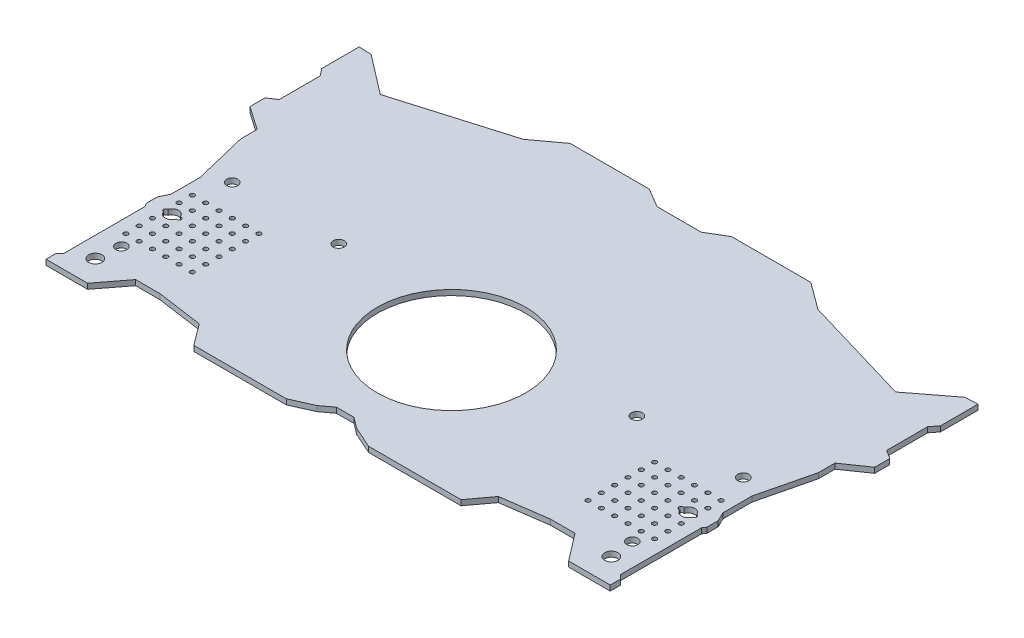
from build123d import *

# Parameters (mm, degrees)
CROQUIS1_R              = 1.5
CROQUIS1_R_2            = 1.25
CROQUIS1_R_3            = 0.5
CROQUIS1_R_4            = 16.7385
SALIENTE_EXTRUIR1_DEPTH = 1.2


with BuildPart() as part:
    # Croquis1 → Saliente-Extruir1 (new body)
    with BuildSketch(Plane(origin=(0, 0, 0), x_dir=(1, 0, 0), z_dir=(0, 1, 0))):
        Polygon((-2.771345295, 39.386037037), (-7.047345295, 41.930037037), (-24.910345295, 41.930037037), (-30.983345295, 37.451037037), (-55.870345295, 30.085037037), (-64.724345295, 36.871037037), (-67.534345295, 36.997037037), (-67.534345295, 28.550037037), (-66.267345295, 26.929037037), (-66.267345295, 17.685037037), (-68.205345295, 16.424037037), (-68.205345295, 13.036037037), (-62.917345295, 9.371037037), (-62.917345295, 5.635037037), (-59.989345295, -6.392962963), (-59.991845295, -12.965462963), (-60.994345295, -15.057962963), (-60.994345295, -17.608962963), (-60.508345295, -18.283962963), (-60.508345295, -36.567962963), (-61.380345295, -37.497962963), (-61.380345295, -39.774962963), (-52.005345295, -39.774962963), (-47.313345295, -33.644962963), (-41.787345295, -33.644962963), (-31.487345295, -35.104962963), (-27.910345295, -39.930962963), (-7.047345295, -39.930962963), (-2.276345295, -37.799962963), (0.263654705, -35.915962963), (4.190654705, -35.915962963), (6.730654705, -37.799962963), (11.501654705, -39.930962963), (32.364654705, -39.930962963), (35.941654705, -35.104962963), (46.241654705, -33.644962963), (51.767654705, -33.644962963), (56.459654705, -39.774962963), (65.834654705, -39.774962963), (65.834654705, -37.497962963), (64.962654705, -36.567962963), (64.962654705, -18.283962963), (65.448654705, -17.608962963), (65.448654705, -15.057962963), (64.446154705, -12.965462963), (64.443654705, -6.392962963), (67.371654705, 5.635037037), (67.371654705, 9.371037037), (72.659654705, 13.036037037), (72.659654705, 16.424037037), (70.721654705, 17.685037037), (70.721654705, 26.929037037), (71.988654705, 28.550037037), (71.988654705, 36.997037037), (69.178654705, 36.871037037), (60.324654705, 30.085037037), (35.437654705, 37.451037037), (29.364654705, 41.930037037), (11.501654705, 41.930037037), (7.225654705, 39.386037037), align=None)
        with Locations(Location((-55.949345295, -34.085962963, 0), (0, 0, 270))):
            Circle(CROQUIS1_R, mode=Mode.SUBTRACT)
        with Locations(Location((-55.382345295, -28.773962963, 0), (0, 0, 270))):
            Circle(CROQUIS1_R_2, mode=Mode.SUBTRACT)
        with Locations(Location((-57.381345295, -25.774962963, 0), (0, 0, 270))):
            Circle(CROQUIS1_R_3, mode=Mode.SUBTRACT)
        with Locations(Location((-54.381345295, -25.774962963, 0), (0, 0, 270))):
            Circle(CROQUIS1_R_3, mode=Mode.SUBTRACT)
        with Locations(Location((-51.381345295, -25.774962963, 0), (0, 0, 270))):
            Circle(CROQUIS1_R_3, mode=Mode.SUBTRACT)
        with Locations(Location((-57.381345295, -22.774962963, 0), (0, 0, 270))):
            Circle(CROQUIS1_R_3, mode=Mode.SUBTRACT)
        with Locations(Location((-54.381345295, -22.774962963, 0), (0, 0, 270))):
            Circle(CROQUIS1_R_3, mode=Mode.SUBTRACT)
        with Locations(Location((-51.381345295, -22.774962963, 0), (0, 0, 270))):
            Circle(CROQUIS1_R_3, mode=Mode.SUBTRACT)
        with Locations(Location((-57.381345295, -19.774962963, 0), (0, 0, 270))):
            Circle(CROQUIS1_R_3, mode=Mode.SUBTRACT)
        with Locations(Location((-54.381345295, -19.774962963, 0), (0, 0, 270))):
            Circle(CROQUIS1_R_3, mode=Mode.SUBTRACT)
        with Locations(Location((-51.381345295, -19.774962963, 0), (0, 0, 270))):
            Circle(CROQUIS1_R_3, mode=Mode.SUBTRACT)
        with Locations(Location((-48.381345295, -25.774962963, 0), (0, 0, 270))):
            Circle(CROQUIS1_R_3, mode=Mode.SUBTRACT)
        with Locations(Location((-45.381345295, -25.774962963, 0), (0, 0, 270))):
            Circle(CROQUIS1_R_3, mode=Mode.SUBTRACT)
        with Locations(Location((-42.381345295, -25.774962963, 0), (0, 0, 270))):
            Circle(CROQUIS1_R_3, mode=Mode.SUBTRACT)
        with Locations(Location((-48.381345295, -22.774962963, 0), (0, 0, 270))):
            Circle(CROQUIS1_R_3, mode=Mode.SUBTRACT)
        with Locations(Location((-45.381345295, -22.774962963, 0), (0, 0, 270))):
            Circle(CROQUIS1_R_3, mode=Mode.SUBTRACT)
        with Locations(Location((-42.381345295, -22.774962963, 0), (0, 0, 270))):
            Circle(CROQUIS1_R_3, mode=Mode.SUBTRACT)
        with Locations(Location((-48.381345295, -19.774962963, 0), (0, 0, 270))):
            Circle(CROQUIS1_R_3, mode=Mode.SUBTRACT)
        with Locations(Location((-45.381345295, -19.774962963, 0), (0, 0, 270))):
            Circle(CROQUIS1_R_3, mode=Mode.SUBTRACT)
        with Locations(Location((-42.381345295, -19.774962963, 0), (0, 0, 270))):
            Circle(CROQUIS1_R_3, mode=Mode.SUBTRACT)
        with BuildLine():
            ThreePointArc((-57.386810711, -16.274992835), (-55.961173074, -15.291061261), (-54.558436037, -16.307374608))
            ThreePointArc((-54.558436037, -16.307374608), (-54.097219769, -16.363535344), (-53.881345295, -16.774962963))
            ThreePointArc((-53.881345295, -16.774962963), (-54.09311223, -17.183523485), (-54.549032095, -17.24600557))
            ThreePointArc((-54.549032095, -17.24600557), (-55.963250738, -18.290887012), (-57.398211259, -17.274678421))
            ThreePointArc((-57.398211259, -17.274678421), (-57.881312785, -16.769261267), (-57.386810711, -16.274992835))
        make_face(mode=Mode.SUBTRACT)
        with Locations(Location((-51.381345295, -16.774962963, 0), (0, 0, 270))):
            Circle(CROQUIS1_R_3, mode=Mode.SUBTRACT)
        with Locations(Location((-57.381345295, -13.774962963, 0), (0, 0, 270))):
            Circle(CROQUIS1_R_3, mode=Mode.SUBTRACT)
        with Locations(Location((-54.381345295, -13.774962963, 0), (0, 0, 270))):
            Circle(CROQUIS1_R_3, mode=Mode.SUBTRACT)
        with Locations(Location((-51.381345295, -13.774962963, 0), (0, 0, 270))):
            Circle(CROQUIS1_R_3, mode=Mode.SUBTRACT)
        with Locations(Location((-57.381345295, -10.774962963, 0), (0, 0, 270))):
            Circle(CROQUIS1_R_3, mode=Mode.SUBTRACT)
        with Locations(Location((-54.381345295, -10.774962963, 0), (0, 0, 270))):
            Circle(CROQUIS1_R_3, mode=Mode.SUBTRACT)
        with Locations(Location((-51.381345295, -10.774962963, 0), (0, 0, 270))):
            Circle(CROQUIS1_R_3, mode=Mode.SUBTRACT)
        with Locations(Location((-48.381345295, -16.774962963, 0), (0, 0, 270))):
            Circle(CROQUIS1_R_3, mode=Mode.SUBTRACT)
        with Locations(Location((-45.381345295, -16.774962963, 0), (0, 0, 270))):
            Circle(CROQUIS1_R_3, mode=Mode.SUBTRACT)
        with Locations(Location((-42.381345295, -16.774962963, 0), (0, 0, 270))):
            Circle(CROQUIS1_R_3, mode=Mode.SUBTRACT)
        with Locations(Location((-48.381345295, -13.774962963, 0), (0, 0, 270))):
            Circle(CROQUIS1_R_3, mode=Mode.SUBTRACT)
        with Locations(Location((-45.381345295, -13.774962963, 0), (0, 0, 270))):
            Circle(CROQUIS1_R_3, mode=Mode.SUBTRACT)
        with Locations(Location((-42.381345295, -13.774962963, 0), (0, 0, 270))):
            Circle(CROQUIS1_R_3, mode=Mode.SUBTRACT)
        with Locations(Location((-48.381345295, -10.774962963, 0), (0, 0, 270))):
            Circle(CROQUIS1_R_3, mode=Mode.SUBTRACT)
        with Locations(Location((-45.381345295, -10.774962963, 0), (0, 0, 270))):
            Circle(CROQUIS1_R_3, mode=Mode.SUBTRACT)
        with Locations(Location((-42.381345295, -10.774962963, 0), (0, 0, 270))):
            Circle(CROQUIS1_R_3, mode=Mode.SUBTRACT)
        with Locations(Location((-55.382345295, -3.773962963, 0), (0, 0, 270))):
            Circle(CROQUIS1_R_2, mode=Mode.SUBTRACT)
        with Locations(Location((2.070654705, -11.794962963, 0), (0, 0, 270))):
            Circle(CROQUIS1_R_4, mode=Mode.SUBTRACT)
        with Locations(Location((-31.382345295, -3.773962963, 0), (0, 0, 270))):
            Circle(CROQUIS1_R_2, mode=Mode.SUBTRACT)
        with Locations(Location((60.403654705, -34.085962963, 0), (0, 0, 270))):
            Circle(CROQUIS1_R, mode=Mode.SUBTRACT)
        with Locations(Location((46.835654705, -25.774962963, 0), (0, 0, 270))):
            Circle(CROQUIS1_R_3, mode=Mode.SUBTRACT)
        with Locations(Location((49.835654705, -25.774962963, 0), (0, 0, 270))):
            Circle(CROQUIS1_R_3, mode=Mode.SUBTRACT)
        with Locations(Location((52.835654705, -25.774962963, 0), (0, 0, 270))):
            Circle(CROQUIS1_R_3, mode=Mode.SUBTRACT)
        with Locations(Location((46.835654705, -22.774962963, 0), (0, 0, 270))):
            Circle(CROQUIS1_R_3, mode=Mode.SUBTRACT)
        with Locations(Location((49.835654705, -22.774962963, 0), (0, 0, 270))):
            Circle(CROQUIS1_R_3, mode=Mode.SUBTRACT)
        with Locations(Location((52.835654705, -22.774962963, 0), (0, 0, 270))):
            Circle(CROQUIS1_R_3, mode=Mode.SUBTRACT)
        with Locations(Location((46.835654705, -19.774962963, 0), (0, 0, 270))):
            Circle(CROQUIS1_R_3, mode=Mode.SUBTRACT)
        with Locations(Location((49.835654705, -19.774962963, 0), (0, 0, 270))):
            Circle(CROQUIS1_R_3, mode=Mode.SUBTRACT)
        with Locations(Location((52.835654705, -19.774962963, 0), (0, 0, 270))):
            Circle(CROQUIS1_R_3, mode=Mode.SUBTRACT)
        with Locations(Location((59.836654705, -28.773962963, 0), (0, 0, 270))):
            Circle(CROQUIS1_R_2, mode=Mode.SUBTRACT)
        with Locations(Location((55.835654705, -25.774962963, 0), (0, 0, 270))):
            Circle(CROQUIS1_R_3, mode=Mode.SUBTRACT)
        with Locations(Location((58.835654705, -25.774962963, 0), (0, 0, 270))):
            Circle(CROQUIS1_R_3, mode=Mode.SUBTRACT)
        with Locations(Location((61.835654705, -25.774962963, 0), (0, 0, 270))):
            Circle(CROQUIS1_R_3, mode=Mode.SUBTRACT)
        with Locations(Location((55.835654705, -22.774962963, 0), (0, 0, 270))):
            Circle(CROQUIS1_R_3, mode=Mode.SUBTRACT)
        with Locations(Location((58.835654705, -22.774962963, 0), (0, 0, 270))):
            Circle(CROQUIS1_R_3, mode=Mode.SUBTRACT)
        with Locations(Location((61.835654705, -22.774962963, 0), (0, 0, 270))):
            Circle(CROQUIS1_R_3, mode=Mode.SUBTRACT)
        with Locations(Location((55.835654705, -19.774962963, 0), (0, 0, 270))):
            Circle(CROQUIS1_R_3, mode=Mode.SUBTRACT)
        with Locations(Location((58.835654705, -19.774962963, 0), (0, 0, 270))):
            Circle(CROQUIS1_R_3, mode=Mode.SUBTRACT)
        with Locations(Location((61.835654705, -19.774962963, 0), (0, 0, 270))):
            Circle(CROQUIS1_R_3, mode=Mode.SUBTRACT)
        with Locations(Location((35.836654705, -3.773962963, 0), (0, 0, 270))):
            Circle(CROQUIS1_R_2, mode=Mode.SUBTRACT)
        with Locations(Location((46.835654705, -16.774962963, 0), (0, 0, 270))):
            Circle(CROQUIS1_R_3, mode=Mode.SUBTRACT)
        with Locations(Location((49.835654705, -16.774962963, 0), (0, 0, 270))):
            Circle(CROQUIS1_R_3, mode=Mode.SUBTRACT)
        with Locations(Location((52.835654705, -16.774962963, 0), (0, 0, 270))):
            Circle(CROQUIS1_R_3, mode=Mode.SUBTRACT)
        with Locations(Location((46.835654705, -13.774962963, 0), (0, 0, 270))):
            Circle(CROQUIS1_R_3, mode=Mode.SUBTRACT)
        with Locations(Location((49.835654705, -13.774962963, 0), (0, 0, 270))):
            Circle(CROQUIS1_R_3, mode=Mode.SUBTRACT)
        with Locations(Location((52.835654705, -13.774962963, 0), (0, 0, 270))):
            Circle(CROQUIS1_R_3, mode=Mode.SUBTRACT)
        with Locations(Location((46.835654705, -10.774962963, 0), (0, 0, 270))):
            Circle(CROQUIS1_R_3, mode=Mode.SUBTRACT)
        with Locations(Location((49.835654705, -10.774962963, 0), (0, 0, 270))):
            Circle(CROQUIS1_R_3, mode=Mode.SUBTRACT)
        with Locations(Location((52.835654705, -10.774962963, 0), (0, 0, 270))):
            Circle(CROQUIS1_R_3, mode=Mode.SUBTRACT)
        with Locations(Location((55.835654705, -16.774962963, 0), (0, 0, 270))):
            Circle(CROQUIS1_R_3, mode=Mode.SUBTRACT)
        with BuildLine():
            ThreePointArc((61.84112012, -16.274992835), (62.19113516, -16.423347198), (62.335654705, -16.774962963))
            ThreePointArc((62.335654705, -16.774962963), (62.195121659, -17.122502182), (61.852520668, -17.274678421))
            ThreePointArc((61.852520668, -17.274678421), (60.417560147, -18.290887012), (59.003341504, -17.24600557))
            ThreePointArc((59.003341504, -17.24600557), (58.335679797, -16.769953822), (59.012745446, -16.307374608))
            ThreePointArc((59.012745446, -16.307374608), (60.415482483, -15.291061261), (61.84112012, -16.274992835))
        make_face(mode=Mode.SUBTRACT)
        with Locations(Location((55.835654705, -13.774962963, 0), (0, 0, 270))):
            Circle(CROQUIS1_R_3, mode=Mode.SUBTRACT)
        with Locations(Location((58.835654705, -13.774962963, 0), (0, 0, 270))):
            Circle(CROQUIS1_R_3, mode=Mode.SUBTRACT)
        with Locations(Location((61.835654705, -13.774962963, 0), (0, 0, 270))):
            Circle(CROQUIS1_R_3, mode=Mode.SUBTRACT)
        with Locations(Location((55.835654705, -10.774962963, 0), (0, 0, 270))):
            Circle(CROQUIS1_R_3, mode=Mode.SUBTRACT)
        with Locations(Location((58.835654705, -10.774962963, 0), (0, 0, 270))):
            Circle(CROQUIS1_R_3, mode=Mode.SUBTRACT)
        with Locations(Location((61.835654705, -10.774962963, 0), (0, 0, 270))):
            Circle(CROQUIS1_R_3, mode=Mode.SUBTRACT)
        with Locations(Location((59.836654705, -3.773962963, 0), (0, 0, 270))):
            Circle(CROQUIS1_R_2, mode=Mode.SUBTRACT)
    extrude(amount=SALIENTE_EXTRUIR1_DEPTH)


solid = part.part
